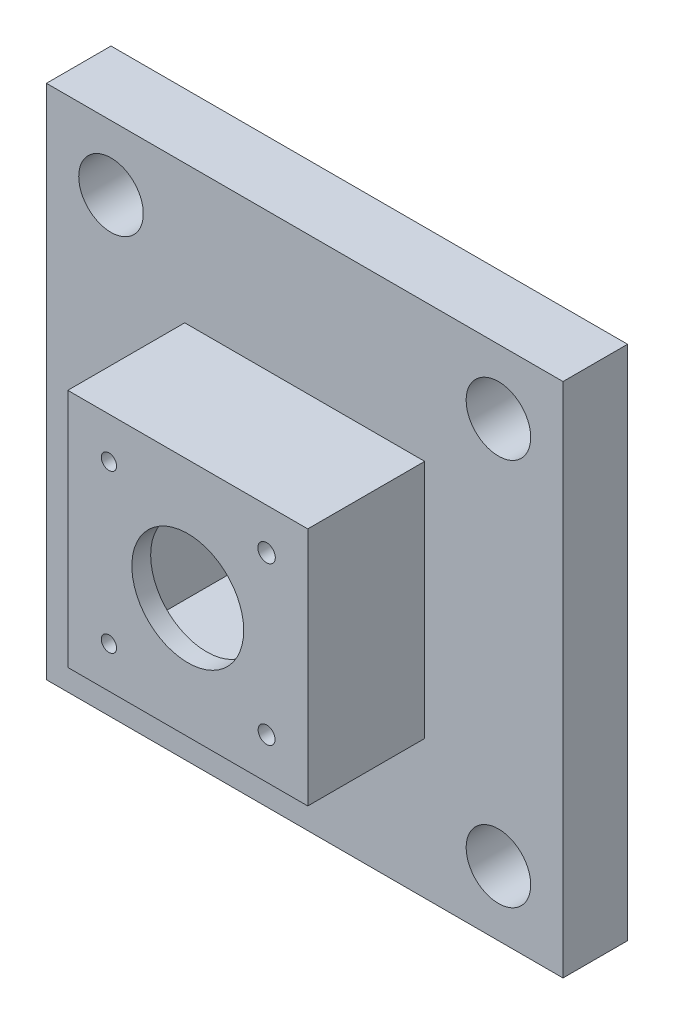
from build123d import *

# Parameters (mm, degrees)
SKETCH1_W           = 101.6
SKETCH1_H           = 101.6
BOSS_EXTRUDE1_DEPTH = 12.7
SKETCH4_W           = 47.2
SKETCH4_H           = 47.2
BOSS_EXTRUDE3_DEPTH = 23
SKETCH5_W           = 42.3
SKETCH5_H           = 42.3
CUT_EXTRUDE1_DEPTH  = 32
SKETCH6_R           = 11
SKETCH6_R_2         = 1.5
SKETCH6_R_3         = 1.715206785
SKETCH6_R_4         = 1.661518809
CUT_EXTRUDE2_DEPTH  = 10
SKETCH7_W           = 5.3
SKETCH7_H           = 10
CUT_EXTRUDE3_DEPTH  = 5
SKETCH8_W           = 5.3
SKETCH8_H           = 10
CUT_EXTRUDE5_DEPTH  = 12.7
SKETCH9_R           = 6.35
CUT_EXTRUDE6_DEPTH  = 12.7


with BuildPart() as part:
    # Sketch1 → Boss-Extrude1 (new body)
    with BuildSketch(Plane.XY):
        with Locations((50.8, 50.8)):
            Rectangle(SKETCH1_W, SKETCH1_H)
    extrude(amount=BOSS_EXTRUDE1_DEPTH)

    # Sketch4 → Boss-Extrude3 (add)
    with BuildSketch(Plane.XY.offset(12.7)):
        with Locations((50.8, 50.8)):
            Rectangle(SKETCH4_W, SKETCH4_H)
    extrude(amount=BOSS_EXTRUDE3_DEPTH)

    # Sketch5 → Cut-Extrude1 (cut)
    with BuildSketch(Plane(origin=(0, 0, 0), x_dir=(-1, 0, 0), z_dir=(0, 0, -1))):
        with Locations((-50.45, 50.45)):
            Rectangle(SKETCH5_W, SKETCH5_H)
    extrude(amount=-CUT_EXTRUDE1_DEPTH, mode=Mode.SUBTRACT)

    # Sketch6 → Cut-Extrude2 (cut)
    with BuildSketch(Plane.XY.offset(35.7)):
        with Locations((50.8, 50.8)):
            Circle(SKETCH6_R)
        with Locations((35.3, 66.3)):
            Circle(SKETCH6_R_2)
        with Locations((66.3, 66.3)):
            Circle(SKETCH6_R_3)
        with Locations((66.3, 35.3)):
            Circle(SKETCH6_R_4)
        with Locations((35.3, 35.3)):
            Circle(SKETCH6_R_2)
    extrude(amount=-CUT_EXTRUDE2_DEPTH, mode=Mode.SUBTRACT)

    # Sketch7 → Cut-Extrude3 (cut)
    with BuildSketch(Plane.ZY.offset(-27.2)):
        with Locations((15.35, 50.8)):
            Rectangle(SKETCH7_W, SKETCH7_H)
    extrude(amount=-CUT_EXTRUDE3_DEPTH, mode=Mode.SUBTRACT)

    # Sketch8 → Cut-Extrude5 (cut)
    with BuildSketch(Plane.XY.offset(12.7)):
        with Locations((24.55, 50.8)):
            Rectangle(SKETCH8_W, SKETCH8_H)
    extrude(amount=-CUT_EXTRUDE5_DEPTH, mode=Mode.SUBTRACT)

    # Sketch9 → Cut-Extrude6 (cut)
    with BuildSketch(Plane(origin=(0, 0, 0), x_dir=(-1, 0, 0), z_dir=(0, 0, -1))):
        with Locations((-88.9, 88.9)):
            Circle(SKETCH9_R)
        with Locations((-12.7, 88.9)):
            Circle(SKETCH9_R)
        with Locations((-12.7, 12.7)):
            Circle(SKETCH9_R)
        with Locations((-88.9, 12.7)):
            Circle(SKETCH9_R)
    extrude(amount=-CUT_EXTRUDE6_DEPTH, mode=Mode.SUBTRACT)


solid = part.part
